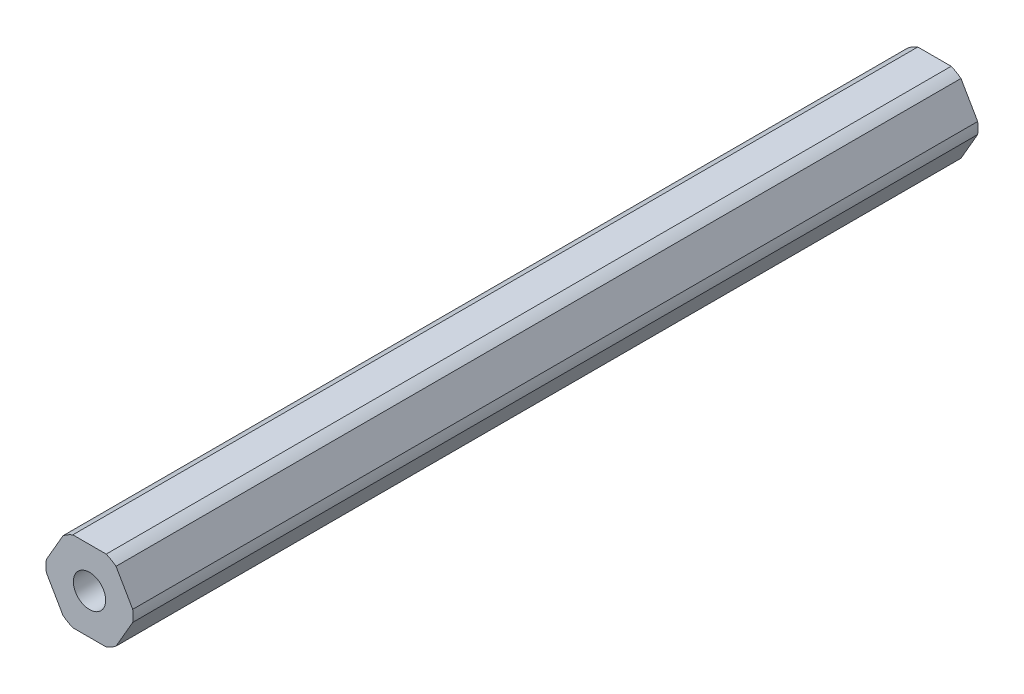
from build123d import *

# Parameters (mm, degrees)
SKETCH1_R           = 2.55
BOSS_EXTRUDE1_DEPTH = 133.35


with BuildPart() as part:
    # Sketch1 → Boss-Extrude1 (new body)
    with BuildSketch(Plane.XY):
        with BuildLine():
            Line((2.634981025, 6.35), (-2.634981025, 6.35))
            ThreePointArc((-2.634981025, 6.35), (-3.4375, 5.953924651), (-4.181770802, 5.456960506))
            Line((-4.181770802, 5.456960506), (-6.816751826, 0.893039494))
            ThreePointArc((-6.816751826, 0.893039494), (-6.875, 0), (-6.816751826, -0.893039494))
            Line((-6.816751826, -0.893039494), (-4.181770802, -5.456960506))
            ThreePointArc((-4.181770802, -5.456960506), (-3.4375, -5.953924651), (-2.634981025, -6.35))
            Line((-2.634981025, -6.35), (2.634981025, -6.35))
            ThreePointArc((2.634981025, -6.35), (3.4375, -5.953924651), (4.181770802, -5.456960506))
            Line((4.181770802, -5.456960506), (6.816751826, -0.893039494))
            ThreePointArc((6.816751826, -0.893039494), (6.875, 0), (6.816751826, 0.893039494))
            Line((6.816751826, 0.893039494), (4.181770802, 5.456960506))
            ThreePointArc((4.181770802, 5.456960506), (3.4375, 5.953924651), (2.634981025, 6.35))
        make_face()
        Circle(SKETCH1_R, mode=Mode.SUBTRACT)
    extrude(amount=BOSS_EXTRUDE1_DEPTH)


solid = part.part
